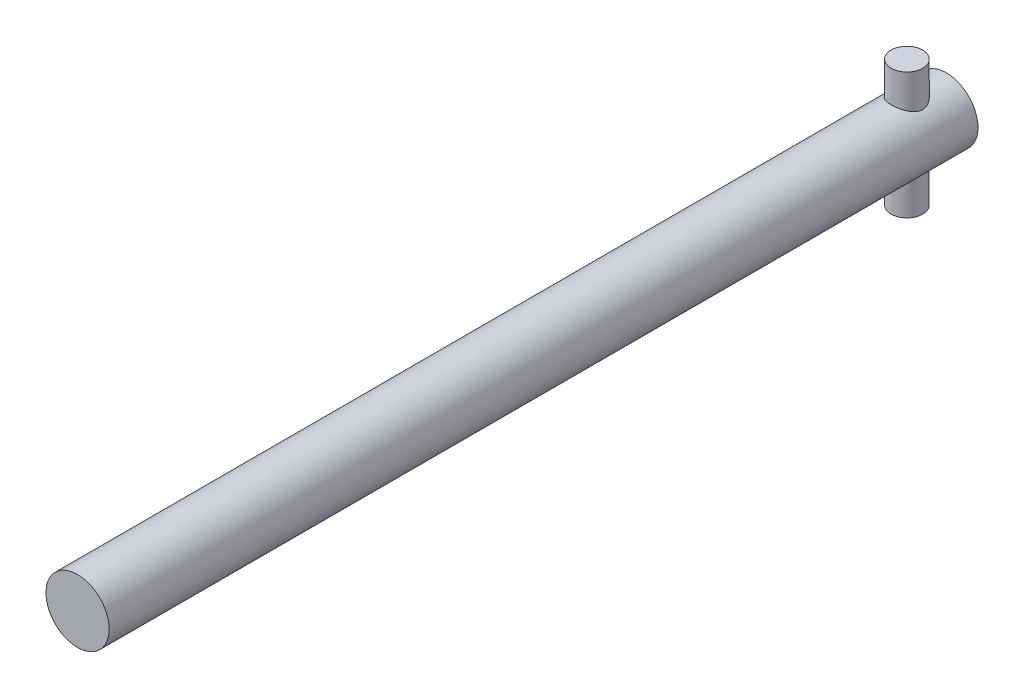
from build123d import *

# Parameters (mm, degrees)
SKETCH1_R                = 4
BOSS_EXTRUDE1_DEPTH      = 110
BOSS_EXTRUDE2_DEPTH      = 8
BOSS_EXTRUDE2_DEPTH_BACK = 8
SKETCH2_R                = 2


with BuildPart() as part:
    # Sketch1 → Boss-Extrude1 (new body)
    with BuildSketch(Plane.XY):
        Circle(SKETCH1_R)
    extrude(amount=BOSS_EXTRUDE1_DEPTH)

    # Sketch2 → Boss-Extrude2 (add, two sides: drawn at the far end of the back side and taken through both)
    with BuildSketch(Plane(origin=(0, 0, 0), x_dir=(1, 0, 0), z_dir=(0, 1, 0)).offset(-BOSS_EXTRUDE2_DEPTH_BACK)):
        with Locations((0, -5)):
            Circle(SKETCH2_R)
    extrude(amount=BOSS_EXTRUDE2_DEPTH + BOSS_EXTRUDE2_DEPTH_BACK)


solid = part.part
